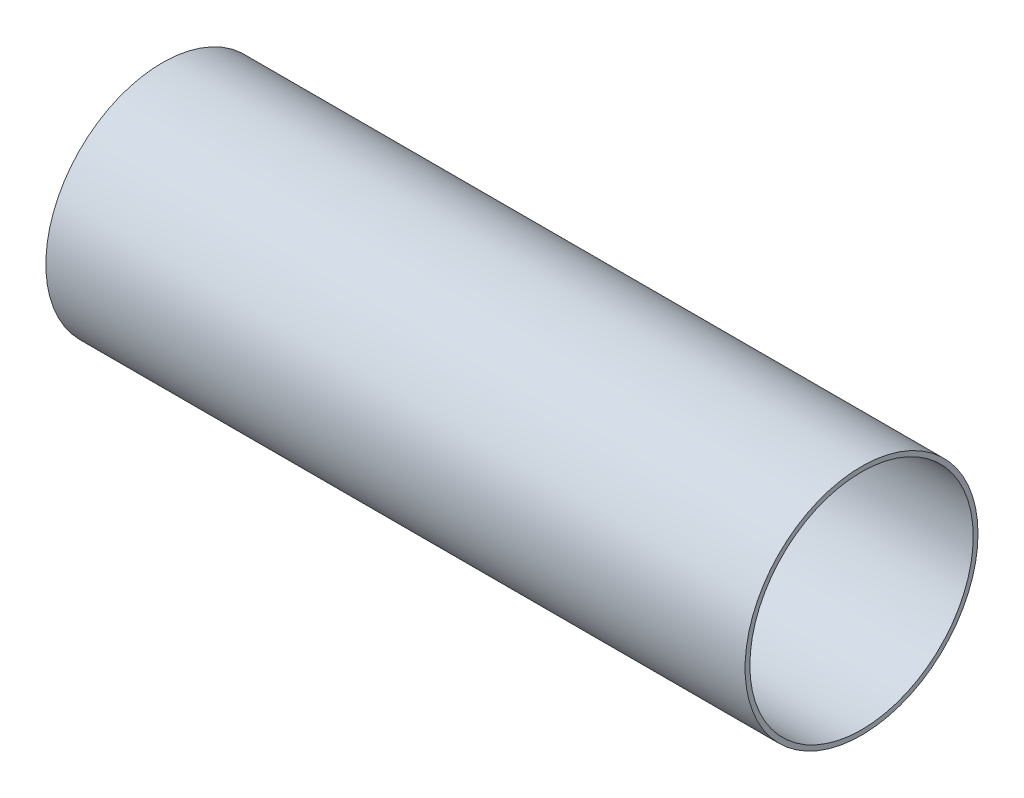
from build123d import *

# Parameters (mm, degrees)
SKETCH1_R           = 38.0746
SKETCH1_R_2         = 36.5125
BOSS_EXTRUDE1_DEPTH = 228.6


with BuildPart() as part:
    # Sketch1 → Boss-Extrude1 (new body)
    with BuildSketch(Plane.YZ):
        with Locations(Location((0, 0, 0), (0, 0, 270))):
            Circle(SKETCH1_R)
        with Locations(Location((0, 0, 0), (0, 0, 270))):
            Circle(SKETCH1_R_2, mode=Mode.SUBTRACT)
    extrude(amount=BOSS_EXTRUDE1_DEPTH)


solid = part.part
